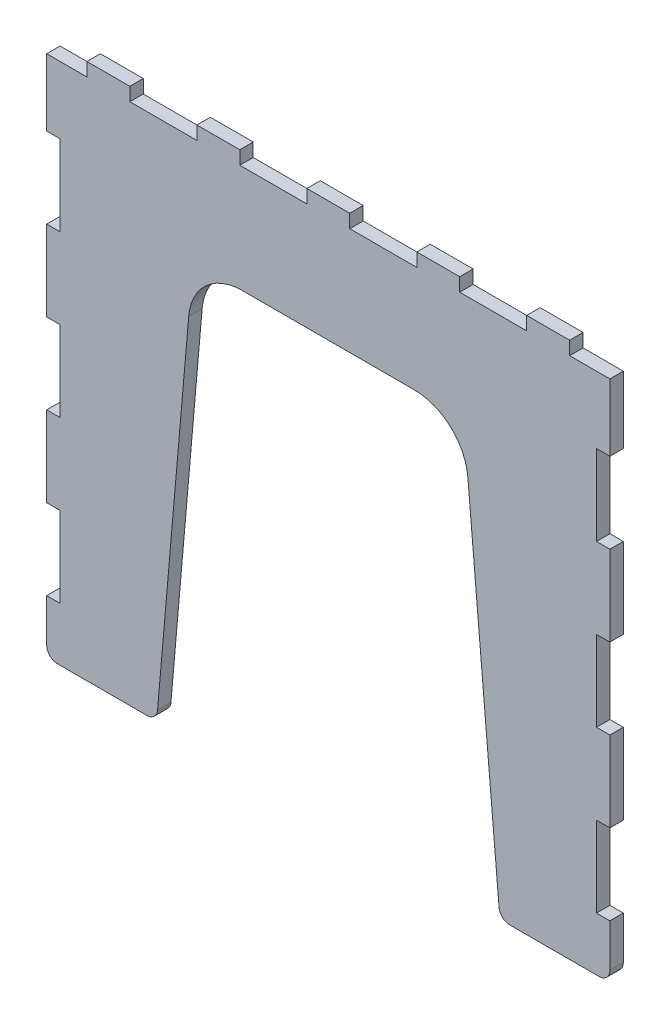
from build123d import *

# Parameters (mm, degrees)
BOSS_EXTRUDE1_DEPTH = 2.5
FILLET1_R           = 2
FILLET2_R           = 10


with BuildPart() as part:
    # Sketch1 → Boss-Extrude1 (new body)
    with BuildSketch(Plane.XY):
        Polygon((-25.219628577, -20), (-32, -97.5), (-52.5, -97.5), (-52.5, -87.5), (-50, -87.5), (-50, -72.5), (-52.5, -72.5), (-52.5, -57.5), (-50, -57.5), (-50, -42.5), (-52.5, -42.5), (-52.5, -27.5), (-50, -27.5), (-50, -12.5), (-52.5, -12.5), (-52.5, 0), (-50, 0), (-45, 0), (-45, 2.5), (-37, 2.5), (-37, 0), (-24.5, 0), (-24.5, 2.5), (-16.5, 2.5), (-16.5, 0), (-4, 0), (-4, 2.5), (4, 2.5), (4, 0), (16.5, 0), (16.5, 2.5), (24.5, 2.5), (24.5, 0), (37, 0), (37, 2.5), (45, 2.5), (45, 0), (50, 0), (52.5, 0), (52.5, -12.5), (50, -12.5), (50, -27.5), (52.5, -27.5), (52.5, -42.5), (50, -42.5), (50, -57.5), (52.5, -57.5), (52.5, -72.5), (50, -72.5), (50, -87.5), (52.5, -87.5), (52.5, -97.5), (32, -97.5), (25.219628577, -20), align=None)
    extrude(amount=BOSS_EXTRUDE1_DEPTH)

    # Fillet1
    fillet1_edges = [part.edges().sort_by_distance(p)[0] for p in [
        (52.5, -97.5, 1.25),
        (32, -97.5, 1.25),
        (-32, -97.5, 1.25),
        (-52.5, -97.5, 1.25),
    ]]
    fillet(fillet1_edges, radius=FILLET1_R)

    # Fillet2
    fillet2_edges = [part.edges().sort_by_distance(p)[0] for p in [
        (25.219628577, -20, 1.25),
        (-25.219628577, -20, 1.25),
    ]]
    fillet(fillet2_edges, radius=FILLET2_R)


solid = part.part
